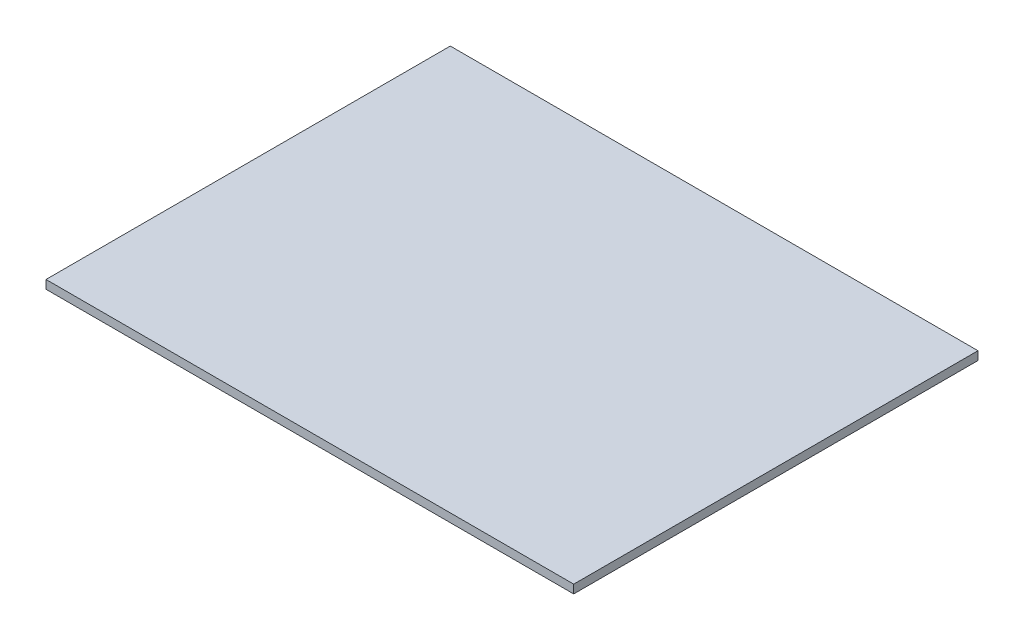
from build123d import *

# Parameters (mm, degrees)
SKETCH1_W           = 496
SKETCH1_H           = 380
BOSS_EXTRUDE1_DEPTH = 8


with BuildPart() as part:
    # Sketch1 → Boss-Extrude1 (new body)
    with BuildSketch(Plane(origin=(0, 0, 0), x_dir=(1, 0, 0), z_dir=(0, 1, 0))):
        Rectangle(SKETCH1_W, SKETCH1_H)
    extrude(amount=BOSS_EXTRUDE1_DEPTH)


solid = part.part
